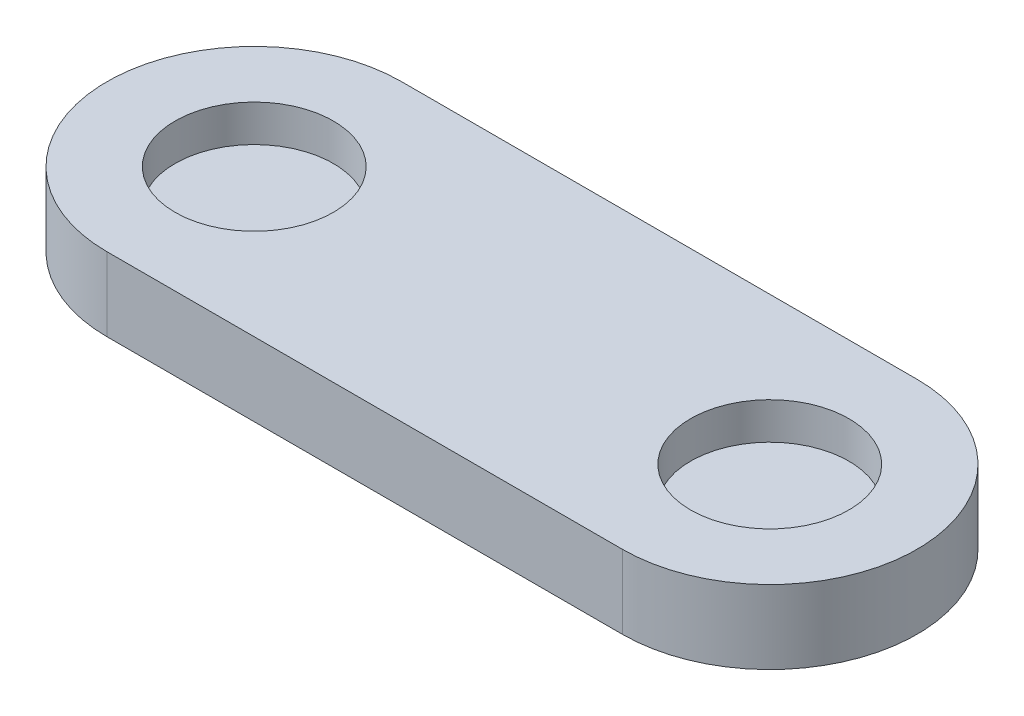
from build123d import *

# Parameters (mm, degrees)
SKETCH1_R           = 2.7305
BOSS_EXTRUDE1_DEPTH = 1.27
BOSS_EXTRUDE2_START = 1.27
BOSS_EXTRUDE2_DEPTH = 1.27


with BuildPart() as part:
    # Sketch1 → Boss-Extrude1 (new body)
    with BuildSketch(Plane(origin=(0, 0, 0), x_dir=(1, 0, 0), z_dir=(0, 1, 0))):
        with BuildLine():
            Line((8.89, -5.08), (-8.89, -5.08))
            ThreePointArc((-8.89, -5.08), (-13.97, 0), (-8.89, 5.08))
            Line((-8.89, 5.08), (8.89, 5.08))
            ThreePointArc((8.89, 5.08), (13.97, 0), (8.89, -5.08))
        make_face()
        with Locations(Location((-8.89, 0, 0), (0, 0, 270))):
            Circle(SKETCH1_R, mode=Mode.SUBTRACT)
        with Locations(Location((8.89, 0, 0), (0, 0, 270))):
            Circle(SKETCH1_R, mode=Mode.SUBTRACT)
    extrude(amount=BOSS_EXTRUDE1_DEPTH)

    # Sketch2 → Boss-Extrude2 (add)
    with BuildSketch(Plane.XZ.offset(BOSS_EXTRUDE2_START)):
        with BuildLine():
            Line((8.89, 5.08), (-8.89, 5.08))
            ThreePointArc((-8.89, 5.08), (-13.97, 0), (-8.89, -5.08))
            Line((-8.89, -5.08), (8.89, -5.08))
            ThreePointArc((8.89, -5.08), (13.97, 0), (8.89, 5.08))
        make_face()
    extrude(amount=-BOSS_EXTRUDE2_DEPTH)


solid = part.part
